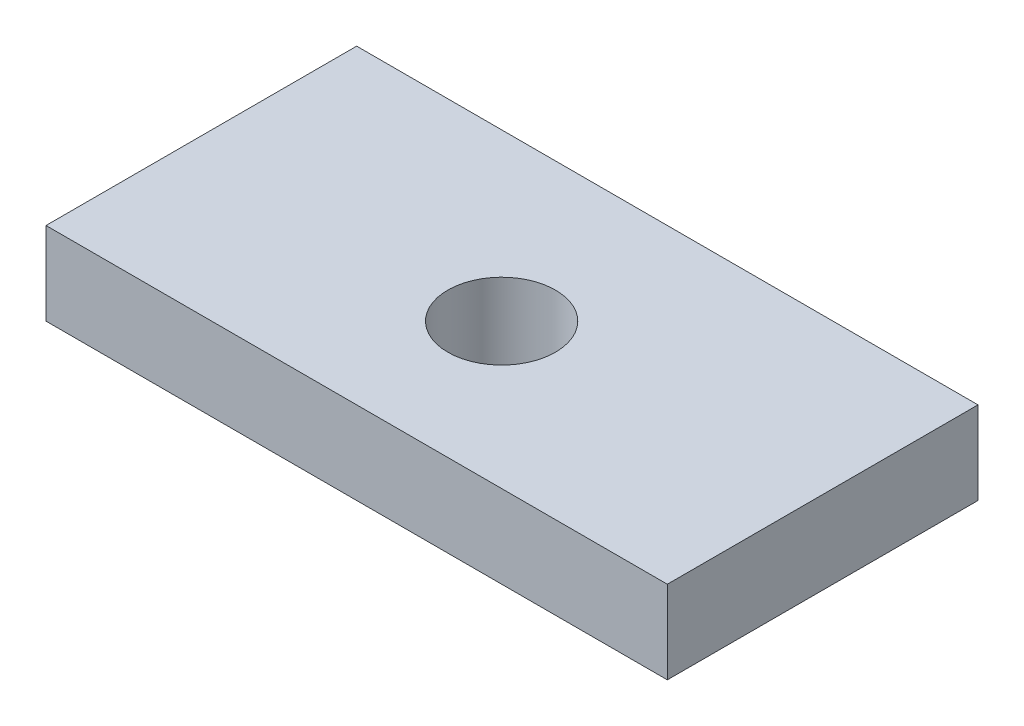
from build123d import *

# Parameters (mm, degrees)
SKETCH_1_W      = 30
SKETCH_1_H      = 15
SKETCH_1_R      = 2.6
EXTRUDE_1_DEPTH = 4


with BuildPart() as part:
    # 草图1 → 凸台-拉伸1 (new body)
    with BuildSketch(Plane(origin=(0, 0, 0), x_dir=(1, 0, 0), z_dir=(0, 1, 0))):
        with Locations((15, 7.5)):
            Rectangle(SKETCH_1_W, SKETCH_1_H)
        with Locations(Location((15, 7, 0), (0, 0, 270))):
            Circle(SKETCH_1_R, mode=Mode.SUBTRACT)
    extrude(amount=EXTRUDE_1_DEPTH)


solid = part.part
